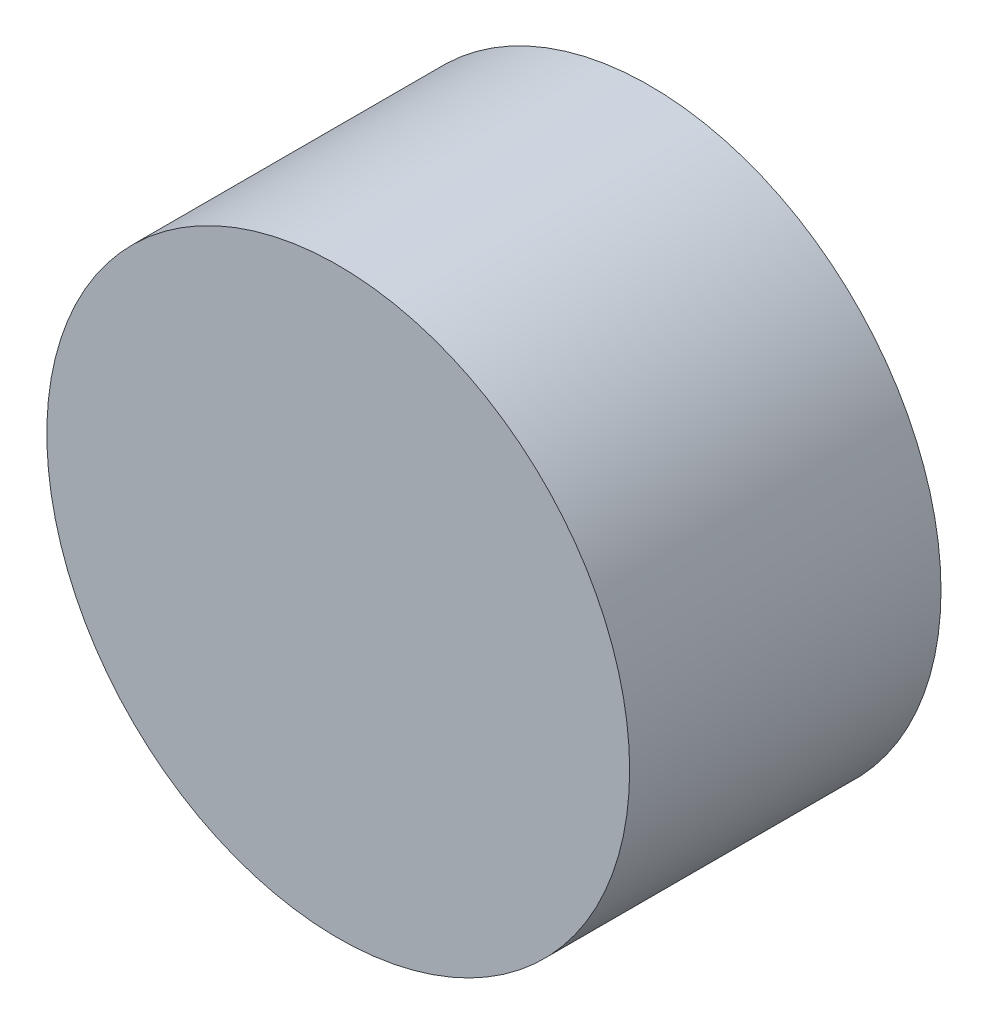
from build123d import *

# Parameters (mm, degrees)
SKETCH1_R           = 15.07617
BOSS_EXTRUDE1_DEPTH = 16.10868
SKETCH2_R           = 9.3853
SKETCH2_R_2         = 4.5847
CUT_EXTRUDE1_DEPTH  = 4.7498


with BuildPart() as part:
    # Sketch1 → Boss-Extrude1 (new body)
    with BuildSketch(Plane.XY):
        Circle(SKETCH1_R)
    extrude(amount=BOSS_EXTRUDE1_DEPTH)

    # Sketch2 → Cut-Extrude1 (cut)
    with BuildSketch(Plane(origin=(0, 0, 0), x_dir=(-1, 0, 0), z_dir=(0, 0, -1))):
        Circle(SKETCH2_R)
        Circle(SKETCH2_R_2, mode=Mode.SUBTRACT)
    extrude(amount=-CUT_EXTRUDE1_DEPTH, mode=Mode.SUBTRACT)


solid = part.part
